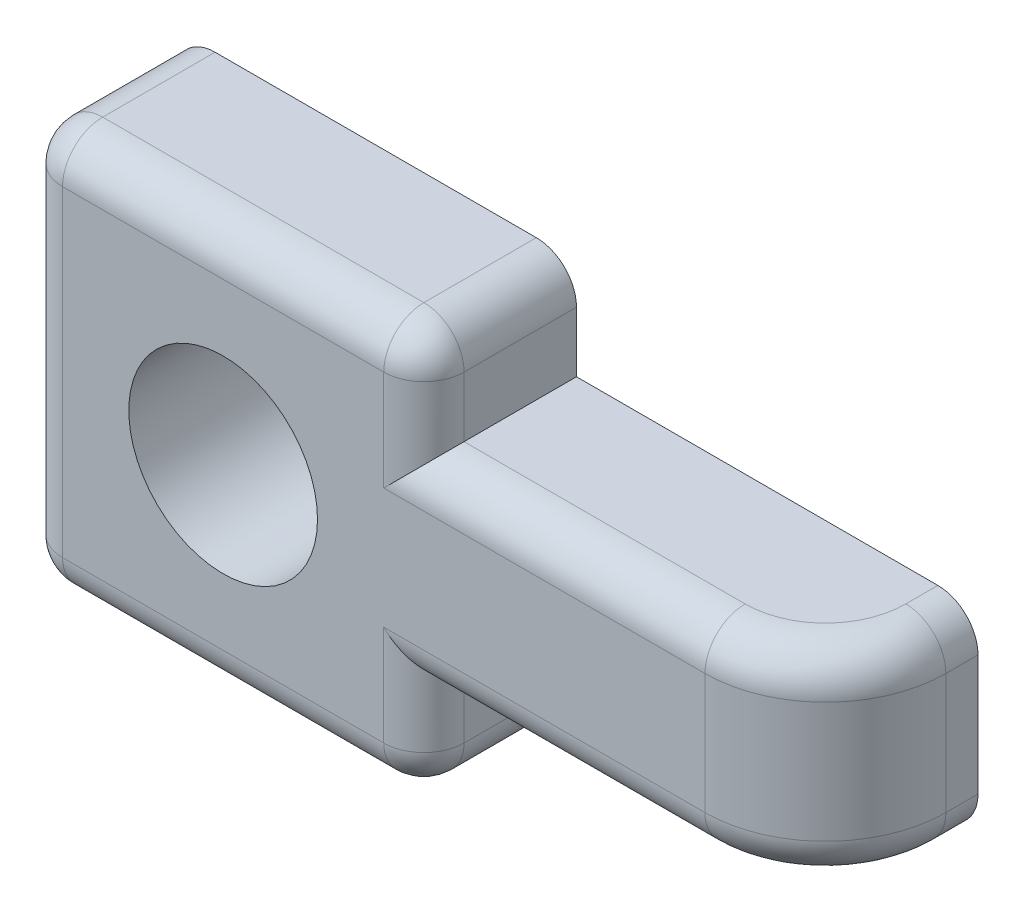
from build123d import *

# Parameters (mm, degrees)
SKETCH_1_W      = 100
SKETCH_1_H      = 25
EXTRUDE_1_DEPTH = 38
FILLET_1_R      = 10
FILLET_2_R      = 30
FILLET_3_R      = 10


with BuildPart() as part:
    # 草图1 → 凸台-拉伸1 (new body)
    with BuildSketch(Plane.XY):
        with BuildLine():
            Line((0, 23.5), (0, 25))
            Line((0, 25), (0, 48.210201589))
            Line((0, 48.210201589), (0, 50))
            Line((0, 50), (-50, 50))
            Line((-50, 50), (-50, 0))
            Line((-50, 0), (-23.5, 0))
            ThreePointArc((-23.5, 0), (-16.617009358, 16.617009358), (0, 23.5))
        make_face()
        with BuildLine():
            Line((50, 0), (23.5, 0))
            ThreePointArc((23.5, 0), (16.617009358, -16.617009358), (0, -23.5))
            Line((0, -23.5), (0, -25))
            Line((0, -25), (50, -25))
            Line((50, -25), (50, 0))
        make_face()
        with BuildLine():
            Line((50, 25), (0, 25))
            Line((0, 25), (0, 23.5))
            ThreePointArc((0, 23.5), (16.617009358, 16.617009358), (23.5, 0))
            Line((23.5, 0), (50, 0))
            Line((50, 0), (50, 25))
        make_face()
        Polygon((0, 48.210201589), (0, 25), (50, 25), (50, 50), (0, 50), align=None)
        with Locations((100, 12.5)):
            Rectangle(SKETCH_1_W, SKETCH_1_H)
        with Locations((100, -12.5)):
            Rectangle(SKETCH_1_W, SKETCH_1_H)
        with BuildLine():
            ThreePointArc((0, -23.5), (-16.617009358, -16.617009358), (-23.5, 0))
            Line((-23.5, 0), (-50, 0))
            Line((-50, 0), (-50, -50))
            Line((-50, -50), (50, -50))
            Line((50, -50), (50, -25))
            Line((50, -25), (0, -25))
            Line((0, -25), (0, -23.5))
        make_face()
    extrude(amount=EXTRUDE_1_DEPTH)

    # 圆角1
    fillet_1_edges = [part.edges().sort_by_distance(p)[0] for p in [
        (50, -50, 19),
        (-50, -50, 19),
        (-50, 50, 19),
        (50, 50, 19),
    ]]
    fillet(fillet_1_edges, radius=FILLET_1_R)

    # 圆角2
    fillet_2_edges = [part.edges().sort_by_distance(p)[0] for p in [
        (150, 0, 38),
    ]]
    fillet(fillet_2_edges, radius=FILLET_2_R)

    # 圆角3
    fillet_3_edges = [part.edges().sort_by_distance(p)[0] for p in [
        (85, 25, 38),
        (50, 32.5, 38),
        (0, 50, 38),
        (-50, 0, 38),
        (0, -50, 38),
        (50, -32.5, 38),
        (-47.071067812, 47.071067812, 38),
        (-47.071067812, -47.071067812, 38),
        (85, -25, 38),
        (47.071067812, -47.071067812, 38),
        (47.071067812, 47.071067812, 38),
        (150, 25, 4),
        (141.213203436, 25, 29.213203436),
        (150, -25, 4),
        (141.213203436, -25, 29.213203436),
    ]]
    fillet(fillet_3_edges, radius=FILLET_3_R)


solid = part.part
